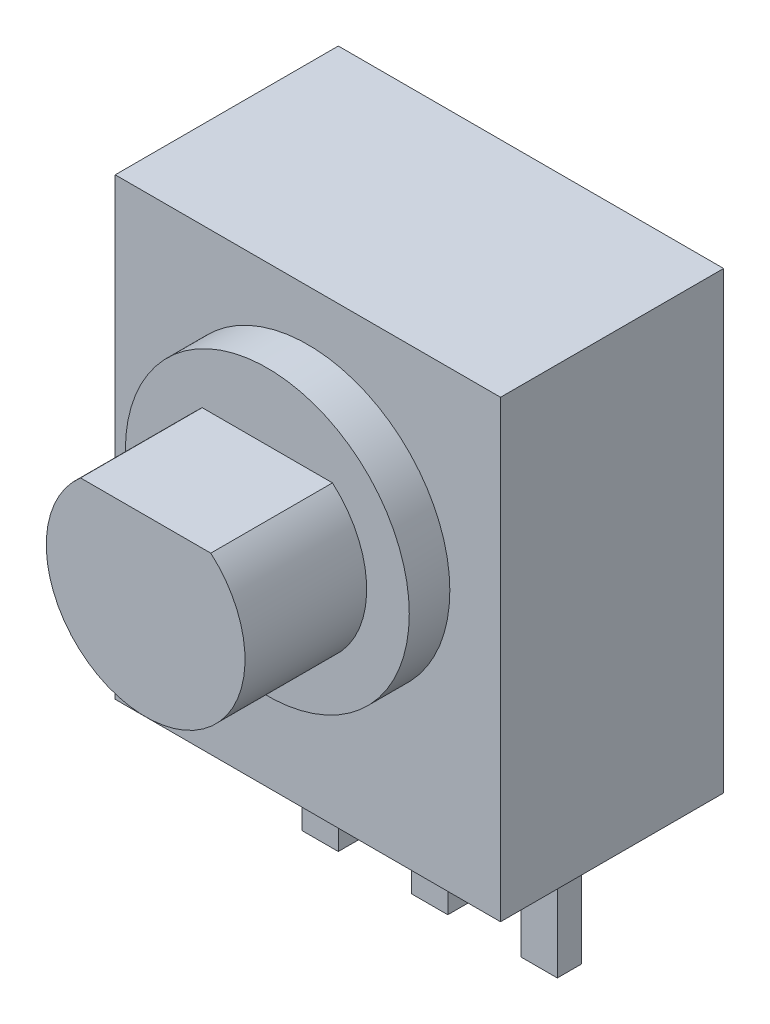
from build123d import *

# Parameters (mm, degrees)
SKETCH1_W           = 9.5
SKETCH1_H           = 9.5
BOSS_EXTRUDE1_DEPTH = 5.5
SKETCH2_W           = 9.5
SKETCH2_H           = 5.5
BOSS_EXTRUDE2_DEPTH = 1.7
SKETCH3_R           = 3.5
BOSS_EXTRUDE3_DEPTH = 1
BOSS_EXTRUDE4_DEPTH = 3
SKETCH5_W           = 0.9
SKETCH5_H           = 0.6
BOSS_EXTRUDE5_DEPTH = 3.5


with BuildPart() as part:
    # Sketch1 → Boss-Extrude1 (new body)
    with BuildSketch(Plane.XY):
        Rectangle(SKETCH1_W, SKETCH1_H)
    extrude(amount=-BOSS_EXTRUDE1_DEPTH)

    # Sketch2 → Boss-Extrude2 (add)
    with BuildSketch(Plane.XZ.offset(4.75)):
        with Locations((0, -2.75)):
            Rectangle(SKETCH2_W, SKETCH2_H)
    extrude(amount=BOSS_EXTRUDE2_DEPTH)

    # Sketch3 → Boss-Extrude3 (add)
    with BuildSketch(Plane.XY):
        Circle(SKETCH3_R)
    extrude(amount=BOSS_EXTRUDE3_DEPTH)

    # Sketch4 → Boss-Extrude4 (add)
    with BuildSketch(Plane.XY.offset(1)):
        with BuildLine():
            Line((-1.60623784, 1.85), (1.60623784, 1.85))
            ThreePointArc((1.60623784, 1.85), (0, -2.45), (-1.60623784, 1.85))
        make_face()
    extrude(amount=BOSS_EXTRUDE4_DEPTH)

    # Sketch5 → Boss-Extrude5 (add)
    with BuildSketch(Plane.XZ.offset(6.45)):
        with Locations((-2.7, -3.3)):
            Rectangle(SKETCH5_W, SKETCH5_H)
        with Locations((0, -3.3)):
            Rectangle(SKETCH5_W, SKETCH5_H)
        with Locations((2.7, -3.3)):
            Rectangle(SKETCH5_W, SKETCH5_H)
    extrude(amount=BOSS_EXTRUDE5_DEPTH)


solid = part.part
